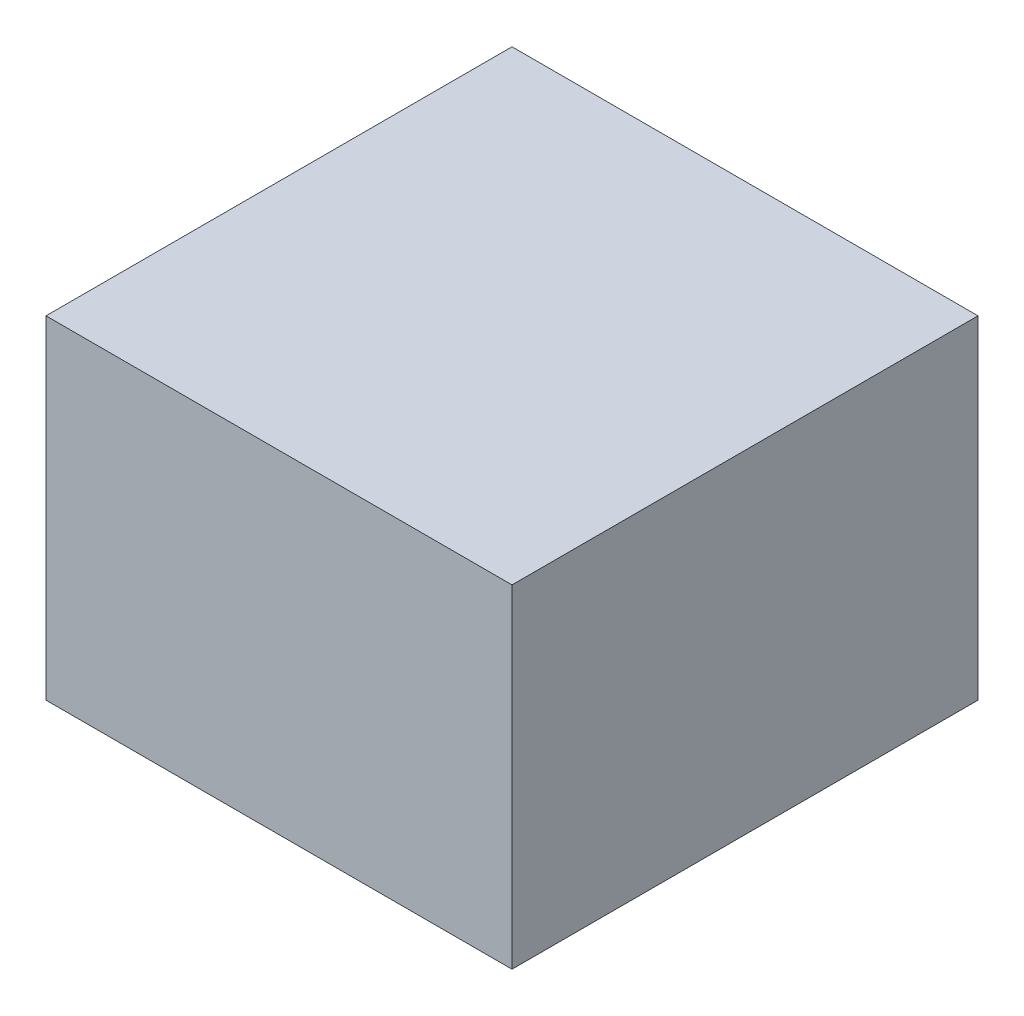
from build123d import *

# Parameters (mm, degrees)
SKETCH1_W           = 700
SKETCH1_H           = 700
BOSS_EXTRUDE1_DEPTH = 250


with BuildPart() as part:
    # Sketch1 → Boss-Extrude1 (new, symmetric)
    with BuildSketch(Plane(origin=(0, 0, 0), x_dir=(1, 0, 0), z_dir=(0, 1, 0))):
        Rectangle(SKETCH1_W, SKETCH1_H)
    extrude(amount=BOSS_EXTRUDE1_DEPTH, both=True)


solid = part.part
